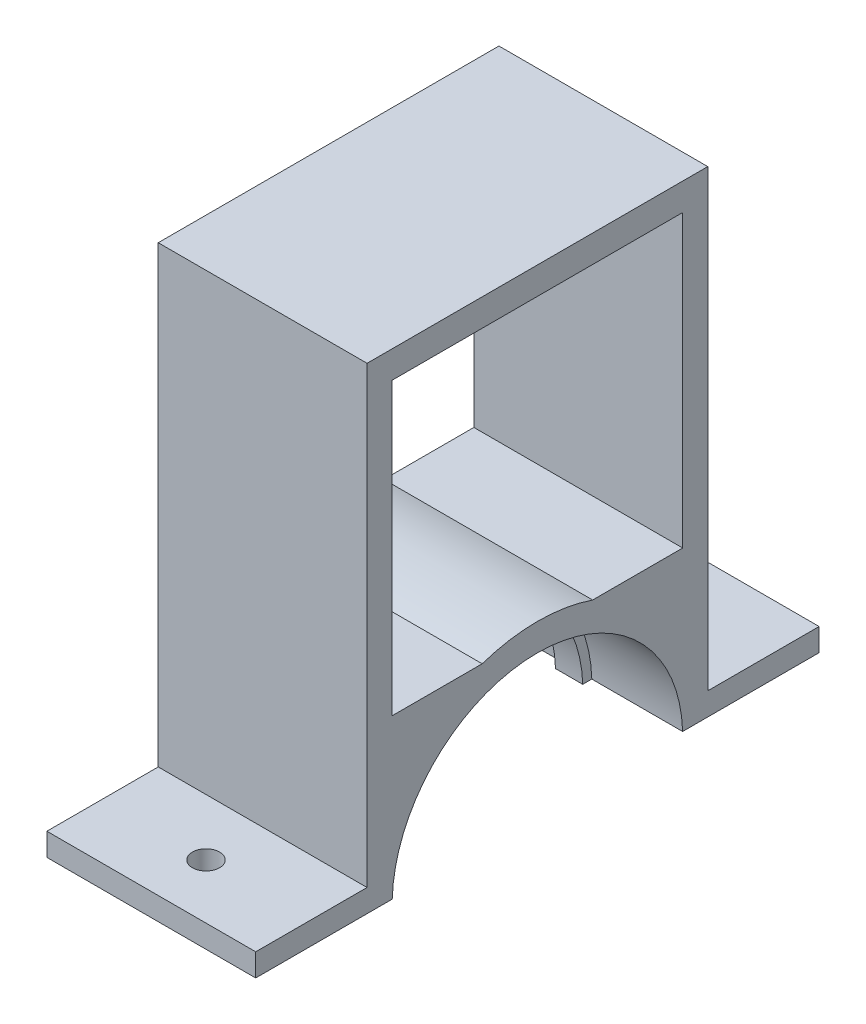
from build123d import *

# Parameters (mm, degrees)
SKETCH3_W           = 13.566130208
SKETCH3_H           = 6
BOSS_EXTRUDE1_DEPTH = 11.5
SKETCH4_R           = 1.5
CUT_EXTRUDE1_DEPTH  = 11.5
SKETCH5_W           = 75.75040558
SKETCH5_H           = 1
CUT_EXTRUDE2_DEPTH  = 26
BOSS_EXTRUDE2_DEPTH = 11.5


with BuildPart() as part:
    # Sketch2 → Revolve1 (revolve)
    with BuildSketch(Plane(origin=(0, 0, 0), x_dir=(1, 0, 0), z_dir=(0, 1, 0)), mode=Mode.PRIVATE) as revolve1_sk:
        Polygon((-11.5, 16), (-1.5, 16), (-1.5, 15), (1.5, 15), (1.5, 16), (11.5, 16), (11.5, 19), (-11.5, 19), align=None)
    revolve(revolve1_sk.sketch.rotate(Axis((-71.722155375, 0, 0), (1, 0, 0)), 180), axis=Axis((-71.722155375, 0, 0), (1, 0, 0)))

    # Sketch3 → Boss-Extrude1 (add, symmetric)
    with BuildSketch(Plane(origin=(0, 0, 0), x_dir=(0, 0, -1), z_dir=(1, 0, 0))):
        with Locations((24.243185686, 0)):
            Rectangle(SKETCH3_W, SKETCH3_H)
        with Locations((-24.243185686, 0)):
            Rectangle(SKETCH3_W, SKETCH3_H)
    extrude(amount=BOSS_EXTRUDE1_DEPTH, both=True)

    # Sketch4 → Cut-Extrude1 (cut, symmetric)
    with BuildSketch(Plane(origin=(0, 0, 0), x_dir=(1, 0, 0), z_dir=(0, 1, 0))):
        with Locations(Location((0, 25, 0), (0, 0, 270))):
            Circle(SKETCH4_R)
        with Locations(Location((0, -25, 0), (0, 0, 270))):
            Circle(SKETCH4_R)
    extrude(amount=CUT_EXTRUDE1_DEPTH, both=True, mode=Mode.SUBTRACT)

    # Sketch5 → Cut-Extrude2 (cut, symmetric)
    with BuildSketch(Plane(origin=(0, 0, 0), x_dir=(0, 0, -1), z_dir=(1, 0, 0))):
        Rectangle(SKETCH5_W, SKETCH5_H)
    extrude(amount=CUT_EXTRUDE2_DEPTH, both=True, mode=Mode.SUBTRACT)


with BuildPart() as cut_extrude2_piece_1:
    # of the separate pieces the step leaves, piece 1, a body of its own (cut_extrude2_pieces)
    add(part.part.solids().sort_by_distance((-11.5, 0.5, -15.992185592))[0])

    # Sketch7 → Boss-Extrude2 (add, symmetric)
    with BuildSketch(Plane(origin=(0, 0, 0), x_dir=(0, 0, -1), z_dir=(1, 0, 0))):
        with BuildLine():
            Line((-18.761663039, 53), (-18.761663039, 3))
            ThreePointArc((-18.761663039, 3), (-14.510732941, 12.265342618), (-6.08276253, 18))
            Line((-6.08276253, 18), (-16, 18))
            Line((-16, 18), (-16, 50))
            Line((-16, 50), (16, 50))
            Line((16, 50), (16, 18))
            Line((16, 18), (6.08276253, 18))
            ThreePointArc((6.08276253, 18), (14.510732941, 12.265342618), (18.761663039, 3))
            Line((18.761663039, 3), (18.761663039, 53))
            Line((18.761663039, 53), (-18.761663039, 53))
        make_face()
    extrude(amount=BOSS_EXTRUDE2_DEPTH, both=True)


with BuildPart() as cut_extrude2_piece_2:
    # of the separate pieces the step leaves, piece 2, a body of its own (cut_extrude2_pieces)
    add(part.part.solids().sort_by_distance((-11.5, -0.5, 15.992185592))[0])


solid = cut_extrude2_piece_1.part
